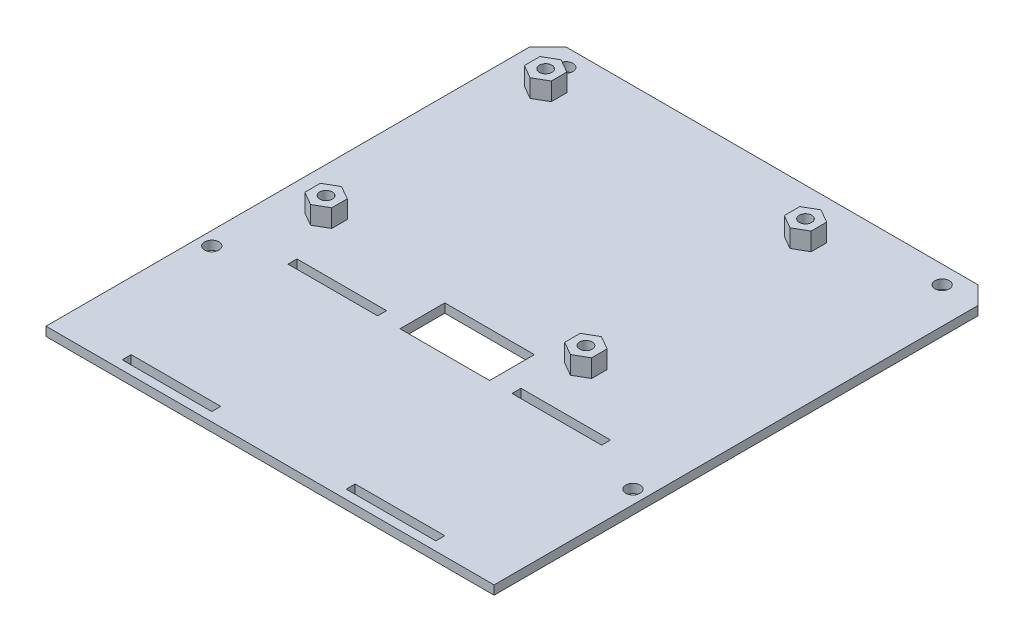
from build123d import *

# Parameters (mm, degrees)
SKETCH1_W           = 100
SKETCH1_H           = 82
BOSS_EXTRUDE1_DEPTH = 2
CHAMFER1_SIZE       = 4
SKETCH2_R           = 1.6
CUT_EXTRUDE1_DEPTH  = 130.336769714
SKETCH3_W           = 100
SKETCH3_H           = 2
BOSS_EXTRUDE2_DEPTH = 30
SKETCH4_W           = 20
SKETCH4_H           = 2
CUT_EXTRUDE2_DEPTH  = 130.336769714
BOSS_EXTRUDE3_DEPTH = 4
SKETCH6_R           = 1.4
CUT_EXTRUDE3_DEPTH  = 130.460418661
SKETCH7_W           = 20
SKETCH7_H           = 10
CUT_EXTRUDE4_DEPTH  = 130.383151917


with BuildPart() as part:
    # Sketch1 → Boss-Extrude1 (new body)
    with BuildSketch(Plane(origin=(0, 0, 0), x_dir=(1, 0, 0), z_dir=(0, 1, 0))):
        with Locations((50, 41)):
            Rectangle(SKETCH1_W, SKETCH1_H)
    extrude(amount=BOSS_EXTRUDE1_DEPTH)

    # Chamfer1
    chamfer1_edges = [part.edges().sort_by_distance(p)[0] for p in [
        (0, 1, -82),
        (100, 1, -82),
    ]]
    chamfer(chamfer1_edges, length=CHAMFER1_SIZE)

    # Sketch2 → Cut-Extrude1 (cut, through all)
    with BuildSketch(Plane(origin=(0, 2, 0), x_dir=(1, 0, 0), z_dir=(0, 1, 0))):
        with Locations(Location((8, 78, 0), (0, 0, 270))):
            Circle(SKETCH2_R)
        with Locations(Location((92, 78, 0), (0, 0, 270))):
            Circle(SKETCH2_R)
        with Locations(Location((97, 4, 0), (0, 0, 270))):
            Circle(SKETCH2_R)
        with Locations(Location((3, 4, 0), (0, 0, 270))):
            Circle(SKETCH2_R)
    extrude(amount=-CUT_EXTRUDE1_DEPTH, mode=Mode.SUBTRACT)

    # Sketch3 → Boss-Extrude2 (add)
    with BuildSketch(Plane.XY):
        with Locations((50, 1)):
            Rectangle(SKETCH3_W, SKETCH3_H)
    extrude(amount=BOSS_EXTRUDE2_DEPTH)

    # Sketch4 → Cut-Extrude2 (cut, through all)
    with BuildSketch(Plane(origin=(0, 2, 0), x_dir=(1, 0, 0), z_dir=(0, 1, 0))):
        with Locations((25, -27)):
            Rectangle(SKETCH4_W, SKETCH4_H)
        with Locations((75, -27)):
            Rectangle(SKETCH4_W, SKETCH4_H)
        with Locations((25, 10)):
            Rectangle(SKETCH4_W, SKETCH4_H)
        with Locations((75, 10)):
            Rectangle(SKETCH4_W, SKETCH4_H)
    extrude(amount=-CUT_EXTRUDE2_DEPTH, mode=Mode.SUBTRACT)

    # Sketch5 → Boss-Extrude3 (add)
    with BuildSketch(Plane(origin=(0, 2, 0), x_dir=(1, 0, 0), z_dir=(0, 1, 0))):
        Polygon((10, 68.035898385), (13, 69.767949192), (13, 73.232050808), (10, 74.964101615), (7, 73.232050808), (7, 69.767949192), align=None)
        Polygon((10, 25.964101615), (7, 24.232050808), (7, 20.767949192), (10, 19.035898385), (13, 20.767949192), (13, 24.232050808), align=None)
        Polygon((68, 25.964101615), (65, 24.232050808), (65, 20.767949192), (68, 19.035898385), (71, 20.767949192), (71, 24.232050808), align=None)
        Polygon((68, 68.035898385), (71, 69.767949192), (71, 73.232050808), (68, 74.964101615), (65, 73.232050808), (65, 69.767949192), align=None)
    extrude(amount=BOSS_EXTRUDE3_DEPTH)

    # Sketch6 → Cut-Extrude3 (cut, through all)
    with BuildSketch(Plane(origin=(0, 6, 0), x_dir=(1, 0, 0), z_dir=(0, 1, 0))):
        with Locations(Location((10, 71.5, 0), (0, 0, 270))):
            Circle(SKETCH6_R)
        with Locations(Location((68, 71.5, 0), (0, 0, 270))):
            Circle(SKETCH6_R)
        with Locations(Location((68, 22.5, 0), (0, 0, 270))):
            Circle(SKETCH6_R)
        with Locations(Location((10, 22.5, 0), (0, 0, 270))):
            Circle(SKETCH6_R)
    extrude(amount=-CUT_EXTRUDE3_DEPTH, mode=Mode.SUBTRACT)

    # Sketch7 → Cut-Extrude4 (cut, through all)
    with BuildSketch(Plane(origin=(0, 2, 0), x_dir=(1, 0, 0), z_dir=(0, 1, 0))):
        with Locations((50, 14)):
            Rectangle(SKETCH7_W, SKETCH7_H)
    extrude(amount=-CUT_EXTRUDE4_DEPTH, mode=Mode.SUBTRACT)


solid = part.part
